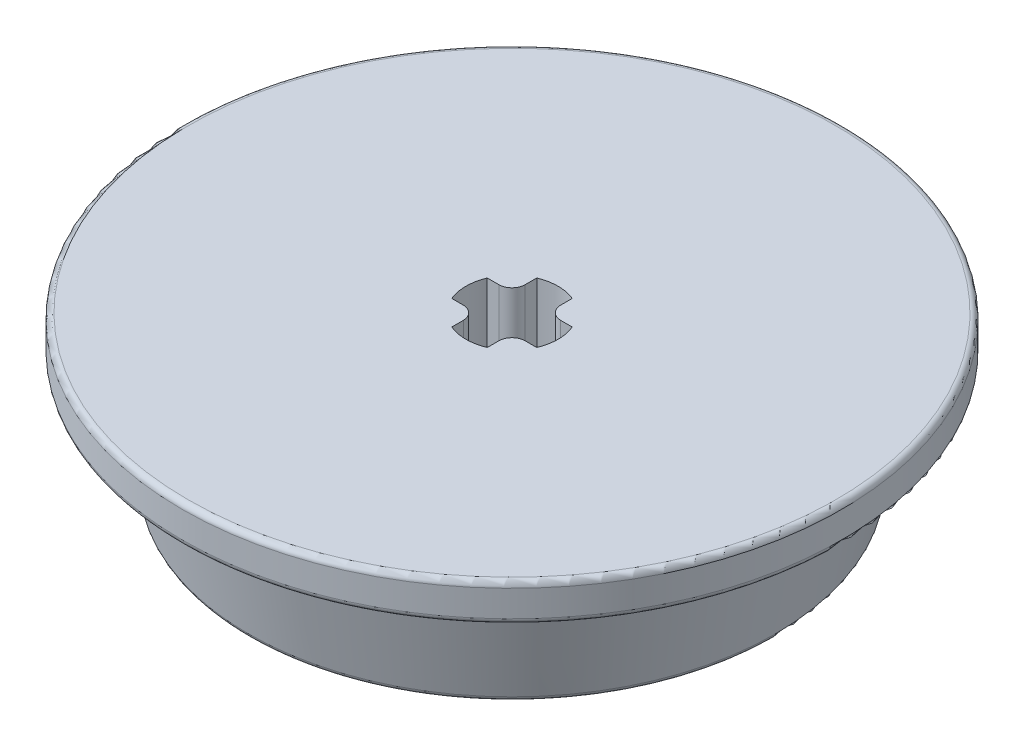
from build123d import *

# Parameters (mm, degrees)
CUT_EXTRUDE1_DEPTH = 26.956426849
FILLET1_R          = 0.7
FILLET2_R          = 0.3


with BuildPart() as part:
    # Sketch2 → Revolve1 (revolve)
    with BuildSketch(Plane.XY, mode=Mode.PRIVATE) as revolve1_sk:
        Polygon((0, 0), (17.460470996, 0), (17.460470996, -2), (15, -2), (13.9155, -8), (0, -8), align=None)
    revolve(revolve1_sk.sketch.rotate(Axis((0, 0, 0), (0, 1, 0)), 90), axis=Axis((0, 0, 0), (0, 1, 0)))

    # Sketch1 → Cut-Extrude1 (cut, through all)
    with BuildSketch(Plane(origin=(0, 0, 0), x_dir=(1, 0, 0), z_dir=(0, 1, 0))):
        with BuildLine():
            Line((-0.94, 0.94), (-2.25166605, 0.94))
            ThreePointArc((-2.25166605, 0.94), (-2.44, 0), (-2.25166605, -0.94))
            Line((-2.25166605, -0.94), (-0.94, -0.94))
            Line((-0.94, -0.94), (-0.94, -2.25166605))
            ThreePointArc((-0.94, -2.25166605), (0, -2.44), (0.94, -2.25166605))
            Line((0.94, -2.25166605), (0.94, -0.94))
            Line((0.94, -0.94), (2.25166605, -0.94))
            ThreePointArc((2.25166605, -0.94), (2.44, 0), (2.25166605, 0.94))
            Line((2.25166605, 0.94), (0.94, 0.94))
            Line((0.94, 0.94), (0.94, 2.25166605))
            ThreePointArc((0.94, 2.25166605), (0, 2.44), (-0.94, 2.25166605))
            Line((-0.94, 2.25166605), (-0.94, 0.94))
        make_face()
    extrude(amount=-CUT_EXTRUDE1_DEPTH, mode=Mode.SUBTRACT)

    # Fillet1
    fillet1_edges = [part.edges().sort_by_distance(p)[0] for p in [
        (-0.94, -4, -0.94),
        (0.94, -4, -0.94),
        (0.94, -4, 0.94),
        (-0.94, -4, 0.94),
    ]]
    fillet(fillet1_edges, radius=FILLET1_R)

    # Fillet2
    fillet2_edges = [part.edges().sort_by_distance(p)[0] for p in [
        (0, -8, 13.9155),
        (0, -2, 15),
        (0, -2, 17.460470996),
        (0, 0, 17.460470996),
    ]]
    fillet(fillet2_edges, radius=FILLET2_R)


solid = part.part
